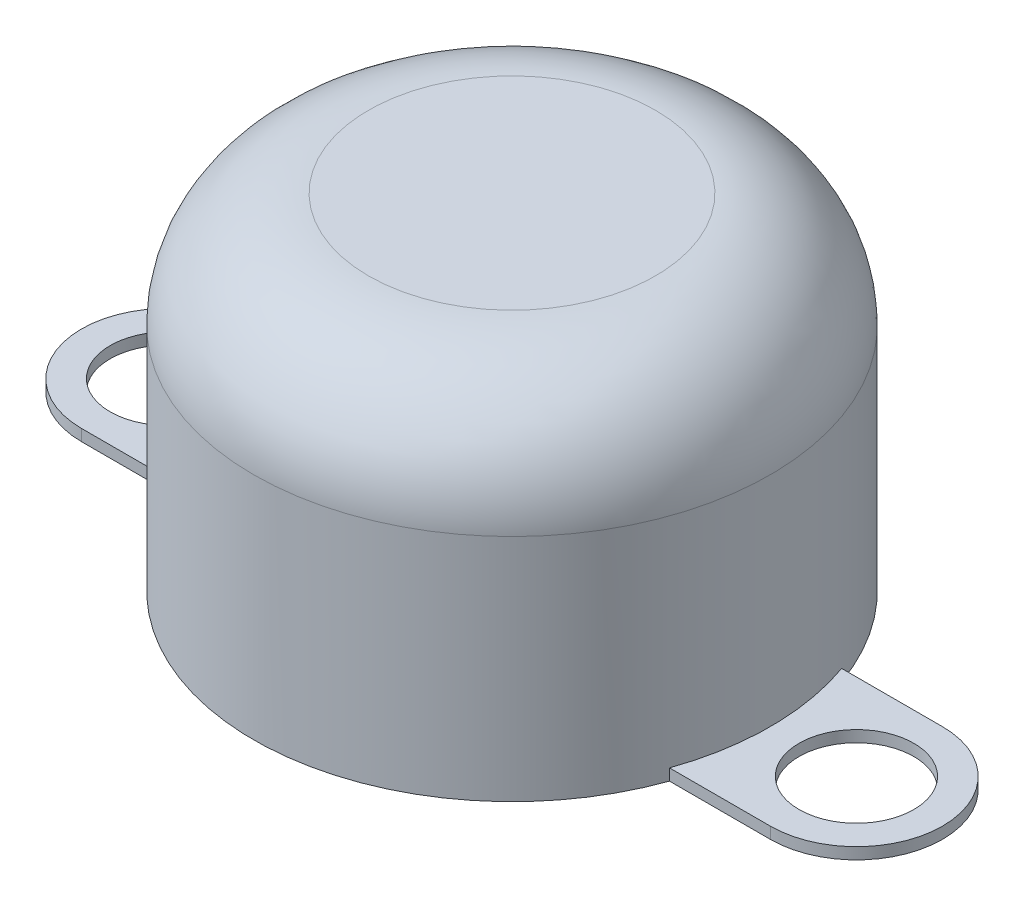
from build123d import *

# Parameters (mm, degrees)
SKETCH_2_R      = 22.5
EXTRUDE_1_DEPTH = 30
FILLET_1_R      = 10
SHELL_1_T       = -1
SKETCH_3_R      = 5
EXTRUDE_2_DEPTH = 1


with BuildPart() as part:
    # 草图2 → 凸台-拉伸1 (new body)
    with BuildSketch(Plane(origin=(0, 0, 0), x_dir=(1, 0, 0), z_dir=(0, 1, 0))):
        with Locations(Location((0, 0, 0), (0, 0, 270))):
            Circle(SKETCH_2_R)
    extrude(amount=EXTRUDE_1_DEPTH)

    # 圆角1
    fillet_1_edges = [part.edges().sort_by_distance(p)[0] for p in [
        (0, 30, -22.5),
    ]]
    fillet(fillet_1_edges, radius=FILLET_1_R)

    # 抽壳1
    shell_1_openings = [part.faces().sort_by_distance(p)[0] for p in [
        (0, 0, 0),
    ]]
    offset(amount=SHELL_1_T, openings=shell_1_openings, kind=Kind.INTERSECTION)

    # 草图3 → 凸台-拉伸2 (add)
    with BuildSketch(Plane(origin=(0, 0, 0), x_dir=(1, 0, 0), z_dir=(0, 1, 0))):
        with BuildLine():
            Line((-21.213203436, 7.5), (-30, 7.5))
            ThreePointArc((-30, 7.5), (-37.5, 0), (-30, -7.5))
            Line((-30, -7.5), (-21.213203436, -7.5))
            ThreePointArc((-21.213203436, -7.5), (-22.5, 0), (-21.213203436, 7.5))
        make_face()
        with Locations(Location((-30, 0, 0), (0, 0, 270))):
            Circle(SKETCH_3_R, mode=Mode.SUBTRACT)
    extrude_2 = extrude(amount=EXTRUDE_2_DEPTH)

    # 镜向1: 凸台-拉伸2 across plane
    add(extrude_2.mirror(Plane(origin=(0, 0, 0), x_dir=(0, 0, 1), z_dir=(1, 0, 0))))


solid = part.part
